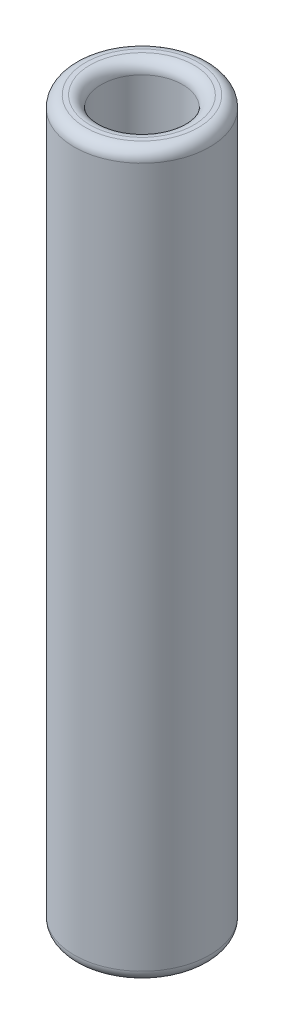
from build123d import *

# Parameters (mm, degrees)
SKETCH1_R           = 3.81
SKETCH1_R_2         = 2.286
BOSS_EXTRUDE1_DEPTH = 40.64
FILLET1_R           = 0.635


with BuildPart() as part:
    # Sketch1 → Boss-Extrude1 (new body)
    with BuildSketch(Plane(origin=(0, 0, 0), x_dir=(1, 0, 0), z_dir=(0, 1, 0))):
        with Locations(Location((0, 0, 0), (0, 0, 270))):
            Circle(SKETCH1_R)
        with Locations(Location((0, 0, 0), (0, 0, 270))):
            Circle(SKETCH1_R_2, mode=Mode.SUBTRACT)
    extrude(amount=BOSS_EXTRUDE1_DEPTH)

    # Fillet1
    fillet1_edges = [part.edges().sort_by_distance(p)[0] for p in [
        (0, 0, -3.81),
        (0, 40.64, -3.81),
        (0, 0, -2.286),
        (0, 40.64, -2.286),
    ]]
    fillet(fillet1_edges, radius=FILLET1_R)


solid = part.part
